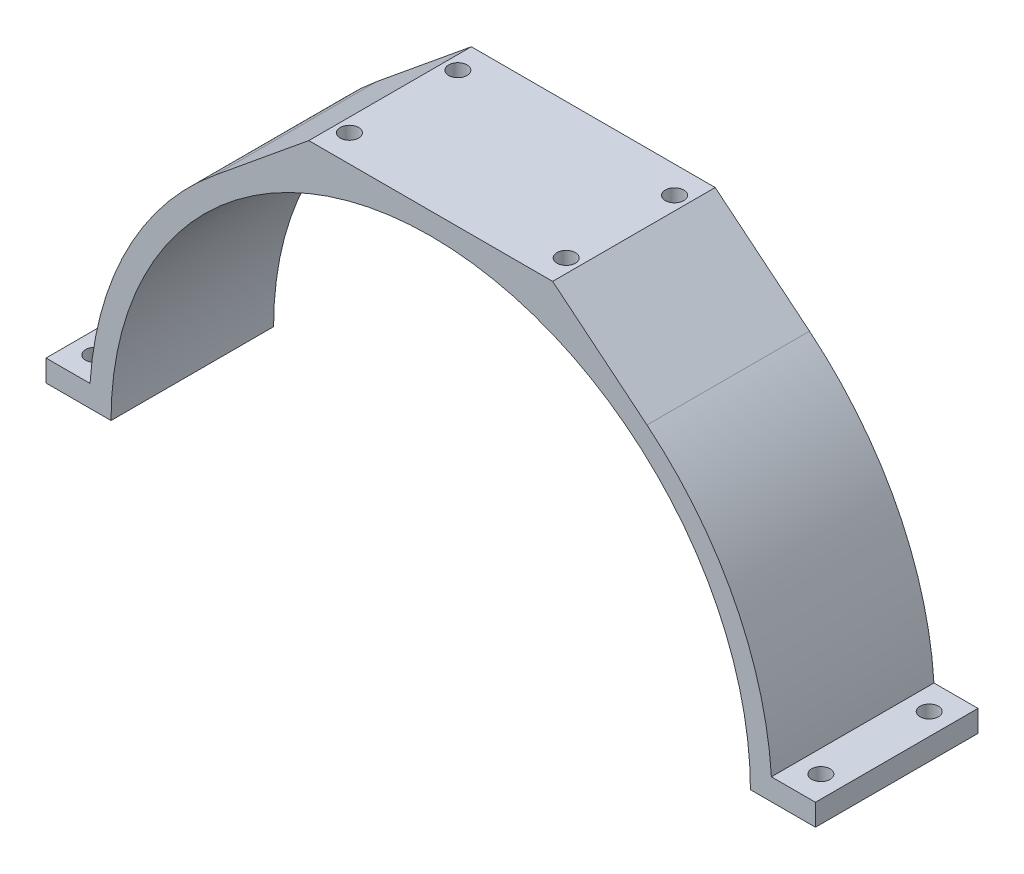
from build123d import *

# Parameters (mm, degrees)
BOSS_EXTRU_1_DEPTH = 30
D_GAGEMENT_M31_D   = 3.4
D_GAGEMENT_M32_D   = 3.4


with BuildPart() as part:
    # Esquisse1 → Boss.-Extru.1 (new body)
    with BuildSketch(Plane.XY):
        with BuildLine():
            Line((22.5, 63), (-22.5, 63))
            Line((-22.5, 63), (-39.909502262, 48.746606335))
            ThreePointArc((-39.909502262, 48.746606335), (-56.050152659, 28.764220604), (-62.872887638, 4))
            Line((-62.872887638, 4), (-71, 4))
            Line((-71, 4), (-71, 0))
            Line((-71, 0), (-59, 0))
            ThreePointArc((-59, 0), (0, 59), (59, 0))
            Line((59, 0), (71, 0))
            Line((71, 0), (71, 4))
            Line((71, 4), (62.872887638, 4))
            ThreePointArc((62.872887638, 4), (56.050152659, 28.764220604), (39.909502262, 48.746606335))
            Line((39.909502262, 48.746606335), (22.5, 63))
        make_face()
    extrude(amount=BOSS_EXTRU_1_DEPTH)

    # Dégagement M31 (through all)
    with Locations(Plane(origin=(0, 4, 0), x_dir=(1, 0, 0), z_dir=(0, 1, 0))):
        with Locations((-67, -25), (-67, -5), (67, -25), (67, -5)):
            Hole(D_GAGEMENT_M31_D / 2)

    # Dégagement M32 (through all)
    with Locations(Plane(origin=(0, 63, 0), x_dir=(1, 0, 0), z_dir=(0, 1, 0))):
        with Locations((20, -5), (-20, -5), (-20, -25), (20, -25)):
            Hole(D_GAGEMENT_M32_D / 2)


solid = part.part
